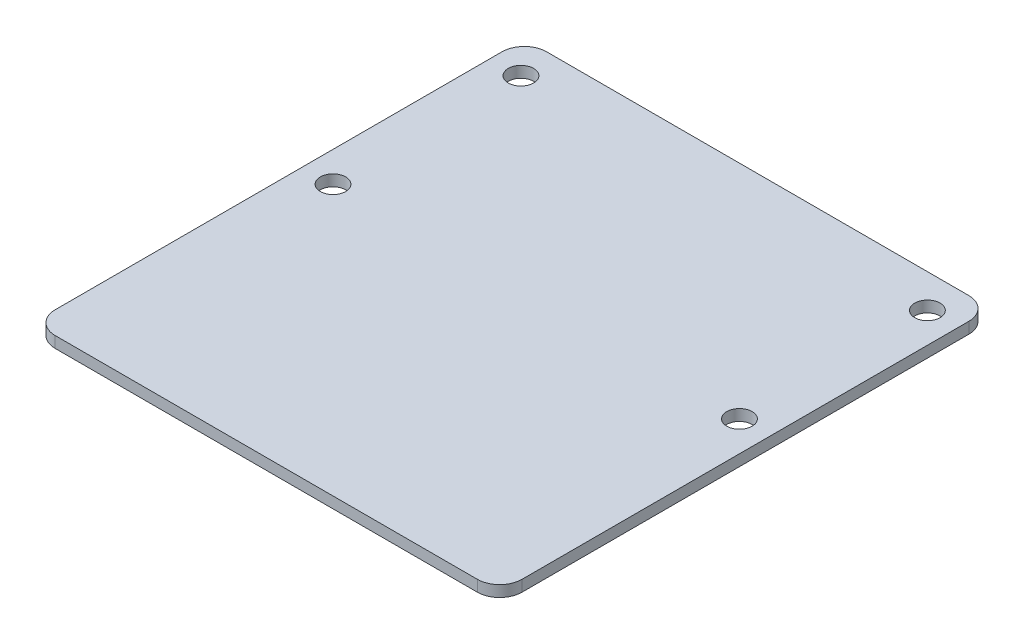
from build123d import *

# Parameters (mm, degrees)
ESQUISSE1_W             = 62.6
ESQUISSE1_H             = 65.9
BOSS_EXTRU_1_DEPTH      = 1.5
CONG_1_R                = 3
ESQUISSE2_R             = 1.7
ENL_V_MAT_EXTRU_1_DEPTH = 46.471337126


with BuildPart() as part:
    # Esquisse1 → Boss.-Extru.1 (new body)
    with BuildSketch(Plane(origin=(0, 0, 0), x_dir=(1, 0, 0), z_dir=(0, 1, 0))):
        Rectangle(ESQUISSE1_W, ESQUISSE1_H)
    extrude(amount=BOSS_EXTRU_1_DEPTH)

    # Congé1
    cong_1_edges = [part.edges().sort_by_distance(p)[0] for p in [
        (31.3, 0.75, 32.95),
        (-31.3, 0.75, 32.95),
        (-31.3, 0.75, -32.95),
        (31.3, 0.75, -32.95),
    ]]
    fillet(cong_1_edges, radius=CONG_1_R)

    # Esquisse2 → Enlèv. mat.-Extru.1 (cut, through all)
    with BuildSketch(Plane(origin=(0, 1.5, 0), x_dir=(1, 0, 0), z_dir=(0, 1, 0))):
        with Locations(Location((-27.25, 28.45, 0), (0, 0, 270))):
            Circle(ESQUISSE2_R)
        with Locations(Location((-27.25, 3.25, 0), (0, 0, 270))):
            Circle(ESQUISSE2_R)
        with Locations(Location((27.25, 28.45, 0), (0, 0, 270))):
            Circle(ESQUISSE2_R)
        with Locations(Location((27.25, 3.25, 0), (0, 0, 270))):
            Circle(ESQUISSE2_R)
    extrude(amount=-ENL_V_MAT_EXTRU_1_DEPTH, mode=Mode.SUBTRACT)


solid = part.part
